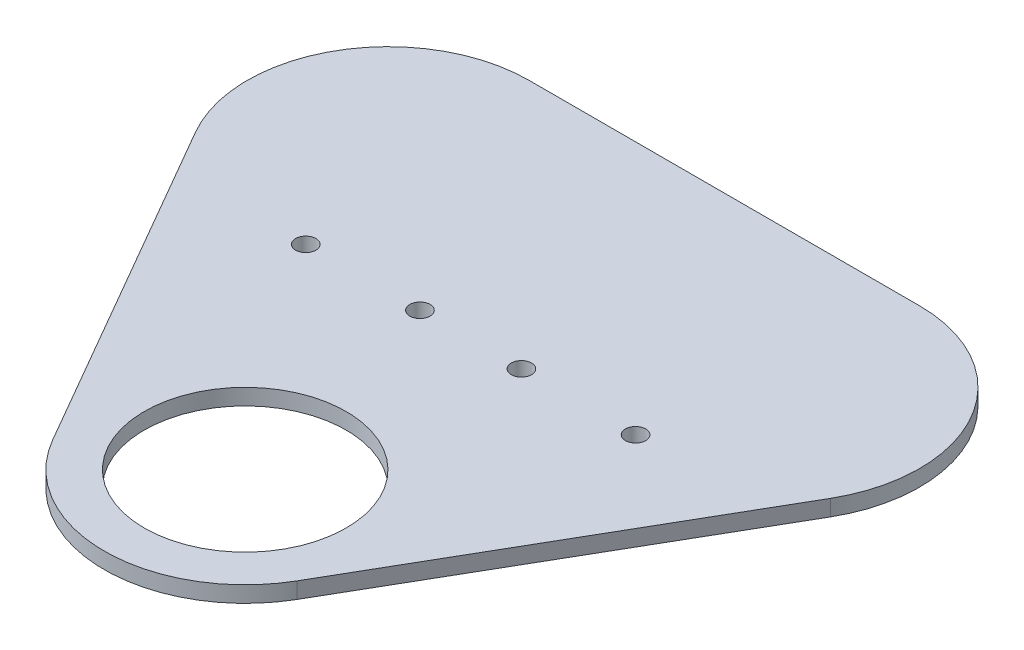
from build123d import *

# Parameters (mm, degrees)
BOSS_EXTRUDE1_DEPTH = 3.175
FILLET1_R           = 27.78
SKETCH5_R           = 2
CUT_EXTRUDE2_DEPTH  = 95.405671522
SKETCH7_R           = 1.5
SKETCH7_R_2         = 3.925
CUT_EXTRUDE3_DEPTH  = 10
SKETCH2_R           = 19.9
CUT_EXTRUDE4_DEPTH  = 95.405671522


with BuildPart() as part:
    # Sketch1 → Boss-Extrude1 (new body)
    with BuildSketch(Plane(origin=(0, 0, 0), x_dir=(1, 0, 0), z_dir=(0, 1, 0))):
        Polygon((0, -94.945058207), (-86.602540378, 55.054941793), (86.602540378, 55.054941793), align=None)
    extrude(amount=BOSS_EXTRUDE1_DEPTH)

    # Fillet1
    fillet1_edges = [part.edges().sort_by_distance(p)[0] for p in [
        (0, 1.5875, 94.945058207),
        (-86.602540378, 1.5875, -55.054941793),
        (86.602540378, 1.5875, -55.054941793),
    ]]
    fillet(fillet1_edges, radius=FILLET1_R)

    # Sketch5 → Cut-Extrude2 (cut, through all)
    with BuildSketch(Plane(origin=(0, 3.175, 0), x_dir=(1, 0, 0), z_dir=(0, 1, 0))):
        with Locations(Location((32.5, 5.054941793, 0), (0, 0, 270))):
            Circle(SKETCH5_R)
        with Locations(Location((-32.5, 5.054941793, 0), (0, 0, 270))):
            Circle(SKETCH5_R)
        with Locations(Location((-10, 5.054941793, 0), (0, 0, 270))):
            Circle(SKETCH5_R)
        with Locations(Location((10, 5.054941793, 0), (0, 0, 270))):
            Circle(SKETCH5_R)
    extrude(amount=-CUT_EXTRUDE2_DEPTH, mode=Mode.SUBTRACT)

    # Sketch7 → Cut-Extrude3 (cut)
    with BuildSketch(Plane(origin=(0, 3.175, 0), x_dir=(1, 0, 0), z_dir=(0, 1, 0))):
        with Locations(Location((0, -30.885058207, 0), (0, 0, 270))):
            Circle(SKETCH7_R)
        with Locations(Location((-7.361215932, -43.635058207, 0), (0, 0, 270))):
            Circle(SKETCH7_R)
        with Locations(Location((0, -39.385058207, 0), (0, 0, 270))):
            Circle(SKETCH7_R_2)
        with Locations(Location((7.361215932, -43.635058207, 0), (0, 0, 270))):
            Circle(SKETCH7_R)
    extrude(amount=-CUT_EXTRUDE3_DEPTH, mode=Mode.SUBTRACT)

    # Sketch2 → Cut-Extrude4 (cut, through all)
    with BuildSketch(Plane(origin=(0, 3.175, 0), x_dir=(1, 0, 0), z_dir=(0, 1, 0))):
        with Locations(Location((0, -39.385058207, 0), (0, 0, 270))):
            Circle(SKETCH2_R)
    extrude(amount=-CUT_EXTRUDE4_DEPTH, mode=Mode.SUBTRACT)


solid = part.part
